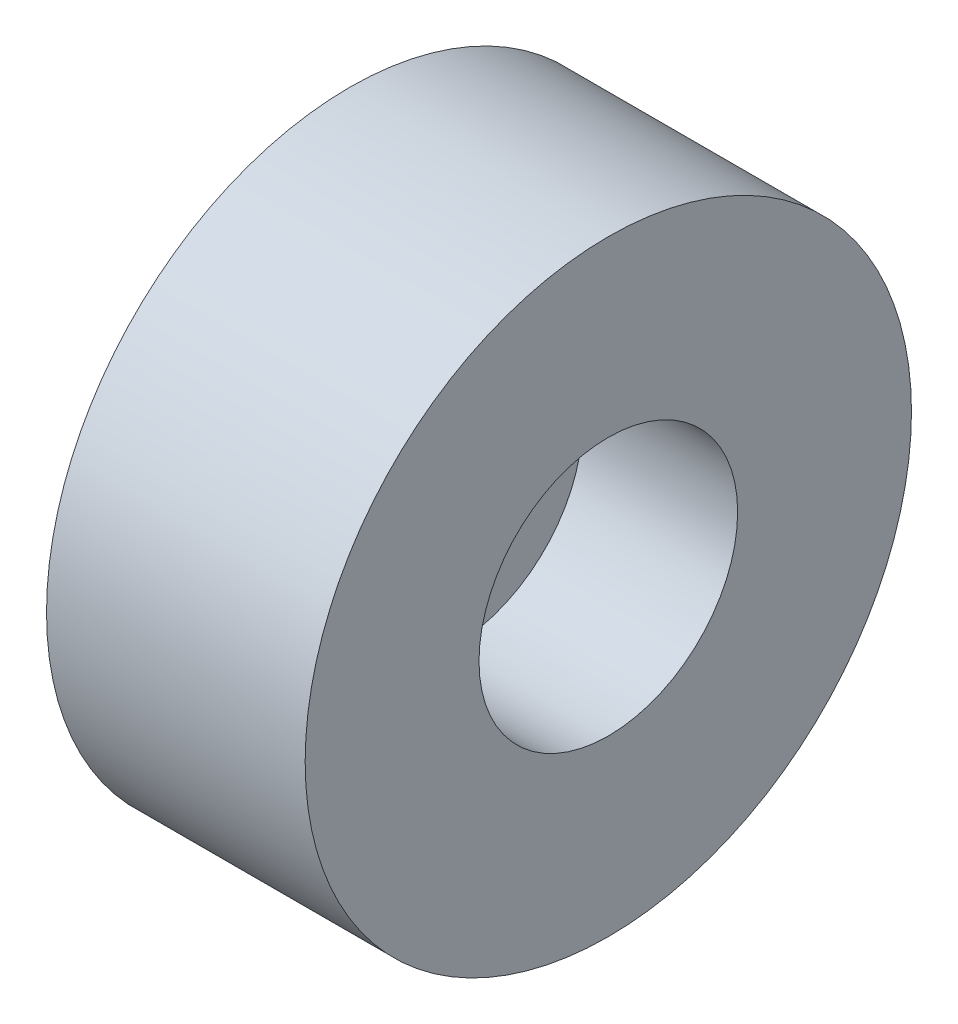
from build123d import *


with BuildPart() as part:
    # Esboço2 → Revolução1 (revolve)
    with BuildSketch(Plane(origin=(0, 0, 0), x_dir=(0, 1, 0), z_dir=(0, 0, 1)), mode=Mode.PRIVATE) as revolu_o1_sk:
        Polygon((-5.860655738, 9.914757538), (-5.860655738, 4.914757538), (-2.5, 4.914757538), (-2.5, 7.914757538), (-1, 7.914757538), (-1, 9.914757538), align=None)
    revolve(revolu_o1_sk.sketch.rotate(Axis((-14.388669057, 0, 0), (1, 0, 0)), 270), axis=Axis((-14.388669057, 0, 0), (1, 0, 0)))


solid = part.part
